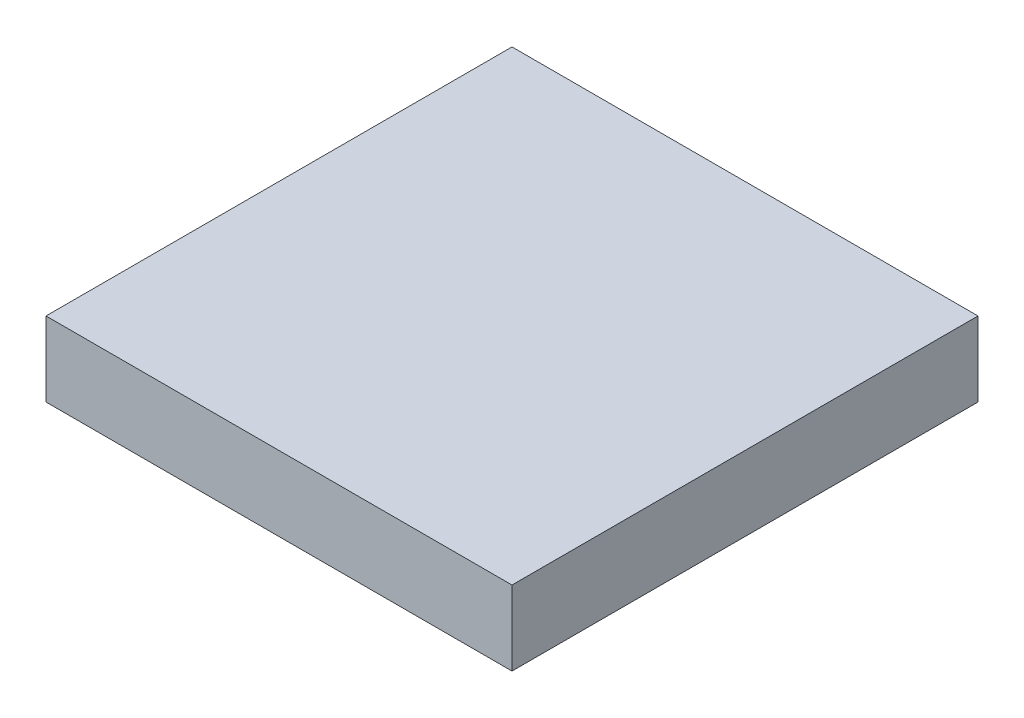
from build123d import *

# Parameters (mm, degrees)
SKETCH1_W          = 50
SKETCH1_H          = 8
BASE_EXTRUDE_DEPTH = 50


with BuildPart() as part:
    # Sketch1 → Base-Extrude (new body)
    with BuildSketch(Plane.XY):
        with Locations((25, 4)):
            Rectangle(SKETCH1_W, SKETCH1_H)
    extrude(amount=-BASE_EXTRUDE_DEPTH)


solid = part.part
